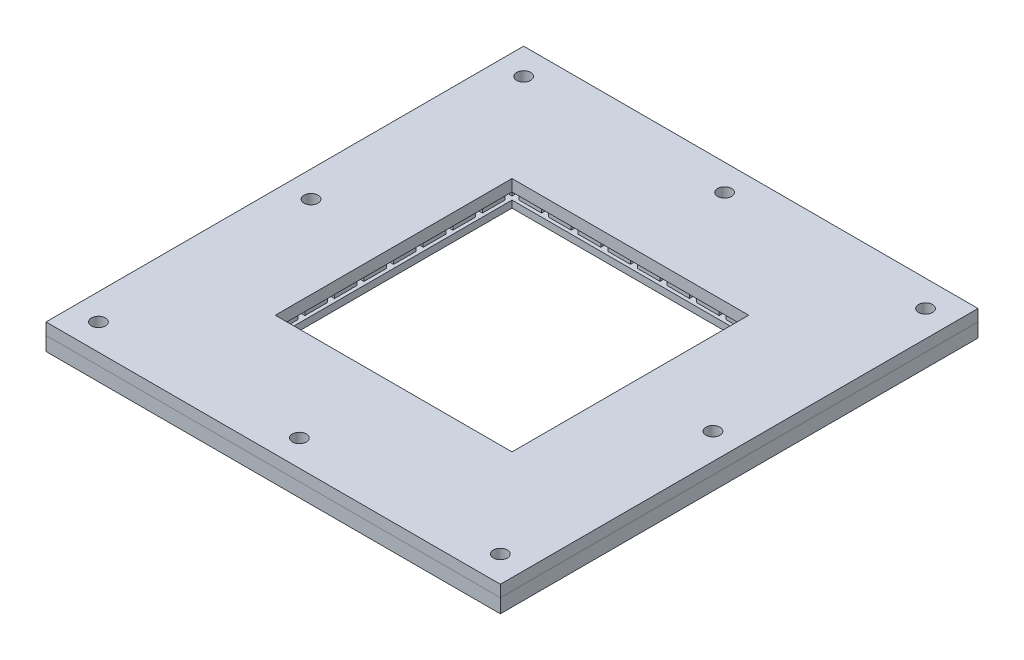
from build123d import *

# Parameters (mm, degrees)
SKETCH1_W                = 195
SKETCH1_H                = 205
SKETCH1_W_2              = 101.6
SKETCH1_H_2              = 101.6
BOSS_EXTRUDE1_DEPTH      = 6
SKETCH2_W                = 152.4
SKETCH2_H                = 3
CUT_EXTRUDE1_DEPTH       = 3
SKETCH3_W                = 3
SKETCH3_H                = 152.4
CUT_EXTRUDE2_DEPTH       = 3
LPATTERN1_COUNT          = 11
LPATTERN1_PITCH          = 12.7
LPATTERN2_COUNT          = 11
LPATTERN2_PITCH          = 12.7
MIRROR1_COPY_1_SKETCH_W  = 152.4
MIRROR1_COPY_1_SKETCH_H  = 3
MIRROR1_COPY_1_DEPTH     = 3
MIRROR1_COPY_2_SKETCH_W  = 152.4
MIRROR1_COPY_2_SKETCH_H  = 3
MIRROR1_COPY_2_DEPTH     = 3
MIRROR1_COPY_3_SKETCH_W  = 152.4
MIRROR1_COPY_3_SKETCH_H  = 3
MIRROR1_COPY_3_DEPTH     = 3
MIRROR1_COPY_4_SKETCH_W  = 152.4
MIRROR1_COPY_4_SKETCH_H  = 3
MIRROR1_COPY_4_DEPTH     = 3
MIRROR1_COPY_5_SKETCH_W  = 152.4
MIRROR1_COPY_5_SKETCH_H  = 3
MIRROR1_COPY_5_DEPTH     = 3
MIRROR1_COPY_6_SKETCH_W  = 152.4
MIRROR1_COPY_6_SKETCH_H  = 3
MIRROR1_COPY_6_DEPTH     = 3
MIRROR1_COPY_7_SKETCH_W  = 152.4
MIRROR1_COPY_7_SKETCH_H  = 3
MIRROR1_COPY_7_DEPTH     = 3
MIRROR1_COPY_8_SKETCH_W  = 152.4
MIRROR1_COPY_8_SKETCH_H  = 3
MIRROR1_COPY_8_DEPTH     = 3
MIRROR1_COPY_9_SKETCH_W  = 152.4
MIRROR1_COPY_9_SKETCH_H  = 3
MIRROR1_COPY_9_DEPTH     = 3
MIRROR1_COPY_10_SKETCH_W = 152.4
MIRROR1_COPY_10_SKETCH_H = 3
MIRROR1_COPY_10_DEPTH    = 3
MIRROR2_COPY_1_SKETCH_W  = 3
MIRROR2_COPY_1_SKETCH_H  = 152.4
MIRROR2_COPY_1_DEPTH     = 3
MIRROR2_COPY_2_SKETCH_W  = 3
MIRROR2_COPY_2_SKETCH_H  = 152.4
MIRROR2_COPY_2_DEPTH     = 3
MIRROR2_COPY_3_SKETCH_W  = 3
MIRROR2_COPY_3_SKETCH_H  = 152.4
MIRROR2_COPY_3_DEPTH     = 3
MIRROR2_COPY_4_SKETCH_W  = 3
MIRROR2_COPY_4_SKETCH_H  = 152.4
MIRROR2_COPY_4_DEPTH     = 3
MIRROR2_COPY_5_SKETCH_W  = 3
MIRROR2_COPY_5_SKETCH_H  = 152.4
MIRROR2_COPY_5_DEPTH     = 3
MIRROR2_COPY_6_SKETCH_W  = 3
MIRROR2_COPY_6_SKETCH_H  = 152.4
MIRROR2_COPY_6_DEPTH     = 3
MIRROR2_COPY_7_SKETCH_W  = 3
MIRROR2_COPY_7_SKETCH_H  = 152.4
MIRROR2_COPY_7_DEPTH     = 3
MIRROR2_COPY_8_SKETCH_W  = 3
MIRROR2_COPY_8_SKETCH_H  = 152.4
MIRROR2_COPY_8_DEPTH     = 3
MIRROR2_COPY_9_SKETCH_W  = 3
MIRROR2_COPY_9_SKETCH_H  = 152.4
MIRROR2_COPY_9_DEPTH     = 3
MIRROR2_COPY_10_SKETCH_W = 3
MIRROR2_COPY_10_SKETCH_H = 152.4
MIRROR2_COPY_10_DEPTH    = 3
SKETCH4_W                = 195
SKETCH4_H                = 205
SKETCH4_W_2              = 101.6
SKETCH4_H_2              = 101.6
BOSS_EXTRUDE2_DEPTH      = 5
SKETCH5_R                = 3
CUT_EXTRUDE3_DEPTH       = 142.892564992


with BuildPart() as part:
    # Sketch1 → Boss-Extrude1 (new body)
    with BuildSketch(Plane(origin=(0, 0, 0), x_dir=(1, 0, 0), z_dir=(0, 1, 0))):
        Rectangle(SKETCH1_W, SKETCH1_H)
        Rectangle(SKETCH1_W_2, SKETCH1_H_2, mode=Mode.SUBTRACT)
    extrude(amount=BOSS_EXTRUDE1_DEPTH)

    # Sketch2 → Cut-Extrude1 (cut)
    with BuildSketch(Plane(origin=(0, 6, 0), x_dir=(1, 0, 0), z_dir=(0, 1, 0))):
        with Locations((0, 76.2)):
            Rectangle(SKETCH2_W, SKETCH2_H)
    cut_extrude1 = extrude(amount=-CUT_EXTRUDE1_DEPTH, mode=Mode.SUBTRACT)

    # Sketch3 → Cut-Extrude2 (cut)
    with BuildSketch(Plane(origin=(0, 6, 0), x_dir=(1, 0, 0), z_dir=(0, 1, 0))):
        with Locations((-76.2, 0)):
            Rectangle(SKETCH3_W, SKETCH3_H)
    cut_extrude2 = extrude(amount=-CUT_EXTRUDE2_DEPTH, mode=Mode.SUBTRACT)

    # LPattern1: Cut-Extrude1 ×11
    with Locations(*[(0, 0, i * LPATTERN1_PITCH) for i in range(1, LPATTERN1_COUNT)]):
        add(cut_extrude1, mode=Mode.SUBTRACT)

    # LPattern2: Cut-Extrude2 ×11
    with Locations(*[(i * LPATTERN2_PITCH, 0, 0) for i in range(1, LPATTERN2_COUNT)]):
        add(cut_extrude2, mode=Mode.SUBTRACT)

    # Mirror1: Cut-Extrude1 across plane
    add(cut_extrude1.mirror(Plane.XY), mode=Mode.SUBTRACT)

    # Mirror1 copy 1 sketch → Mirror1 copy 1 (cut)
    with BuildSketch(Plane(origin=(0, 6, -12.7), x_dir=(1, 0, 0), z_dir=(0, 1, 0))):
        with Locations((0, -76.2)):
            Rectangle(MIRROR1_COPY_1_SKETCH_W, MIRROR1_COPY_1_SKETCH_H)
    extrude(amount=-MIRROR1_COPY_1_DEPTH, mode=Mode.SUBTRACT)

    # Mirror1 copy 2 sketch → Mirror1 copy 2 (cut)
    with BuildSketch(Plane(origin=(0, 6, -25.4), x_dir=(1, 0, 0), z_dir=(0, 1, 0))):
        with Locations((0, -76.2)):
            Rectangle(MIRROR1_COPY_2_SKETCH_W, MIRROR1_COPY_2_SKETCH_H)
    extrude(amount=-MIRROR1_COPY_2_DEPTH, mode=Mode.SUBTRACT)

    # Mirror1 copy 3 sketch → Mirror1 copy 3 (cut)
    with BuildSketch(Plane(origin=(0, 6, -38.1), x_dir=(1, 0, 0), z_dir=(0, 1, 0))):
        with Locations((0, -76.2)):
            Rectangle(MIRROR1_COPY_3_SKETCH_W, MIRROR1_COPY_3_SKETCH_H)
    extrude(amount=-MIRROR1_COPY_3_DEPTH, mode=Mode.SUBTRACT)

    # Mirror1 copy 4 sketch → Mirror1 copy 4 (cut)
    with BuildSketch(Plane(origin=(0, 6, -50.8), x_dir=(1, 0, 0), z_dir=(0, 1, 0))):
        with Locations((0, -76.2)):
            Rectangle(MIRROR1_COPY_4_SKETCH_W, MIRROR1_COPY_4_SKETCH_H)
    extrude(amount=-MIRROR1_COPY_4_DEPTH, mode=Mode.SUBTRACT)

    # Mirror1 copy 5 sketch → Mirror1 copy 5 (cut)
    with BuildSketch(Plane(origin=(0, 6, -63.5), x_dir=(1, 0, 0), z_dir=(0, 1, 0))):
        with Locations((0, -76.2)):
            Rectangle(MIRROR1_COPY_5_SKETCH_W, MIRROR1_COPY_5_SKETCH_H)
    extrude(amount=-MIRROR1_COPY_5_DEPTH, mode=Mode.SUBTRACT)

    # Mirror1 copy 6 sketch → Mirror1 copy 6 (cut)
    with BuildSketch(Plane(origin=(0, 6, -76.2), x_dir=(1, 0, 0), z_dir=(0, 1, 0))):
        with Locations((0, -76.2)):
            Rectangle(MIRROR1_COPY_6_SKETCH_W, MIRROR1_COPY_6_SKETCH_H)
    extrude(amount=-MIRROR1_COPY_6_DEPTH, mode=Mode.SUBTRACT)

    # Mirror1 copy 7 sketch → Mirror1 copy 7 (cut)
    with BuildSketch(Plane(origin=(0, 6, -88.9), x_dir=(1, 0, 0), z_dir=(0, 1, 0))):
        with Locations((0, -76.2)):
            Rectangle(MIRROR1_COPY_7_SKETCH_W, MIRROR1_COPY_7_SKETCH_H)
    extrude(amount=-MIRROR1_COPY_7_DEPTH, mode=Mode.SUBTRACT)

    # Mirror1 copy 8 sketch → Mirror1 copy 8 (cut)
    with BuildSketch(Plane(origin=(0, 6, -101.6), x_dir=(1, 0, 0), z_dir=(0, 1, 0))):
        with Locations((0, -76.2)):
            Rectangle(MIRROR1_COPY_8_SKETCH_W, MIRROR1_COPY_8_SKETCH_H)
    extrude(amount=-MIRROR1_COPY_8_DEPTH, mode=Mode.SUBTRACT)

    # Mirror1 copy 9 sketch → Mirror1 copy 9 (cut)
    with BuildSketch(Plane(origin=(0, 6, -114.3), x_dir=(1, 0, 0), z_dir=(0, 1, 0))):
        with Locations((0, -76.2)):
            Rectangle(MIRROR1_COPY_9_SKETCH_W, MIRROR1_COPY_9_SKETCH_H)
    extrude(amount=-MIRROR1_COPY_9_DEPTH, mode=Mode.SUBTRACT)

    # Mirror1 copy 10 sketch → Mirror1 copy 10 (cut)
    with BuildSketch(Plane(origin=(0, 6, -127), x_dir=(1, 0, 0), z_dir=(0, 1, 0))):
        with Locations((0, -76.2)):
            Rectangle(MIRROR1_COPY_10_SKETCH_W, MIRROR1_COPY_10_SKETCH_H)
    extrude(amount=-MIRROR1_COPY_10_DEPTH, mode=Mode.SUBTRACT)

    # Mirror2: Cut-Extrude2 across plane
    add(cut_extrude2.mirror(Plane(origin=(0, 0, 0), x_dir=(0, 0, 1), z_dir=(1, 0, 0))), mode=Mode.SUBTRACT)

    # Mirror2 copy 1 sketch → Mirror2 copy 1 (cut)
    with BuildSketch(Plane(origin=(-12.7, 6, 0), x_dir=(-1, 0, 0), z_dir=(0, 1, 0))):
        with Locations((-76.2, 0)):
            Rectangle(MIRROR2_COPY_1_SKETCH_W, MIRROR2_COPY_1_SKETCH_H)
    extrude(amount=-MIRROR2_COPY_1_DEPTH, mode=Mode.SUBTRACT)

    # Mirror2 copy 2 sketch → Mirror2 copy 2 (cut)
    with BuildSketch(Plane(origin=(-25.4, 6, 0), x_dir=(-1, 0, 0), z_dir=(0, 1, 0))):
        with Locations((-76.2, 0)):
            Rectangle(MIRROR2_COPY_2_SKETCH_W, MIRROR2_COPY_2_SKETCH_H)
    extrude(amount=-MIRROR2_COPY_2_DEPTH, mode=Mode.SUBTRACT)

    # Mirror2 copy 3 sketch → Mirror2 copy 3 (cut)
    with BuildSketch(Plane(origin=(-38.1, 6, 0), x_dir=(-1, 0, 0), z_dir=(0, 1, 0))):
        with Locations((-76.2, 0)):
            Rectangle(MIRROR2_COPY_3_SKETCH_W, MIRROR2_COPY_3_SKETCH_H)
    extrude(amount=-MIRROR2_COPY_3_DEPTH, mode=Mode.SUBTRACT)

    # Mirror2 copy 4 sketch → Mirror2 copy 4 (cut)
    with BuildSketch(Plane(origin=(-50.8, 6, 0), x_dir=(-1, 0, 0), z_dir=(0, 1, 0))):
        with Locations((-76.2, 0)):
            Rectangle(MIRROR2_COPY_4_SKETCH_W, MIRROR2_COPY_4_SKETCH_H)
    extrude(amount=-MIRROR2_COPY_4_DEPTH, mode=Mode.SUBTRACT)

    # Mirror2 copy 5 sketch → Mirror2 copy 5 (cut)
    with BuildSketch(Plane(origin=(-63.5, 6, 0), x_dir=(-1, 0, 0), z_dir=(0, 1, 0))):
        with Locations((-76.2, 0)):
            Rectangle(MIRROR2_COPY_5_SKETCH_W, MIRROR2_COPY_5_SKETCH_H)
    extrude(amount=-MIRROR2_COPY_5_DEPTH, mode=Mode.SUBTRACT)

    # Mirror2 copy 6 sketch → Mirror2 copy 6 (cut)
    with BuildSketch(Plane(origin=(-76.2, 6, 0), x_dir=(-1, 0, 0), z_dir=(0, 1, 0))):
        with Locations((-76.2, 0)):
            Rectangle(MIRROR2_COPY_6_SKETCH_W, MIRROR2_COPY_6_SKETCH_H)
    extrude(amount=-MIRROR2_COPY_6_DEPTH, mode=Mode.SUBTRACT)

    # Mirror2 copy 7 sketch → Mirror2 copy 7 (cut)
    with BuildSketch(Plane(origin=(-88.9, 6, 0), x_dir=(-1, 0, 0), z_dir=(0, 1, 0))):
        with Locations((-76.2, 0)):
            Rectangle(MIRROR2_COPY_7_SKETCH_W, MIRROR2_COPY_7_SKETCH_H)
    extrude(amount=-MIRROR2_COPY_7_DEPTH, mode=Mode.SUBTRACT)

    # Mirror2 copy 8 sketch → Mirror2 copy 8 (cut)
    with BuildSketch(Plane(origin=(-101.6, 6, 0), x_dir=(-1, 0, 0), z_dir=(0, 1, 0))):
        with Locations((-76.2, 0)):
            Rectangle(MIRROR2_COPY_8_SKETCH_W, MIRROR2_COPY_8_SKETCH_H)
    extrude(amount=-MIRROR2_COPY_8_DEPTH, mode=Mode.SUBTRACT)

    # Mirror2 copy 9 sketch → Mirror2 copy 9 (cut)
    with BuildSketch(Plane(origin=(-114.3, 6, 0), x_dir=(-1, 0, 0), z_dir=(0, 1, 0))):
        with Locations((-76.2, 0)):
            Rectangle(MIRROR2_COPY_9_SKETCH_W, MIRROR2_COPY_9_SKETCH_H)
    extrude(amount=-MIRROR2_COPY_9_DEPTH, mode=Mode.SUBTRACT)

    # Mirror2 copy 10 sketch → Mirror2 copy 10 (cut)
    with BuildSketch(Plane(origin=(-127, 6, 0), x_dir=(-1, 0, 0), z_dir=(0, 1, 0))):
        with Locations((-76.2, 0)):
            Rectangle(MIRROR2_COPY_10_SKETCH_W, MIRROR2_COPY_10_SKETCH_H)
    extrude(amount=-MIRROR2_COPY_10_DEPTH, mode=Mode.SUBTRACT)


with BuildPart() as body_2:
    # Sketch4 → Boss-Extrude2 (new body)
    with BuildSketch(Plane(origin=(0, 6, 0), x_dir=(1, 0, 0), z_dir=(0, 1, 0))):
        Rectangle(SKETCH4_W, SKETCH4_H)
        Rectangle(SKETCH4_W_2, SKETCH4_H_2, mode=Mode.SUBTRACT)
    extrude(amount=BOSS_EXTRUDE2_DEPTH)


with BuildPart() as cut_extrude3_tool:
    # Sketch5 → Cut-Extrude3 (new, through all)
    with BuildSketch(Plane(origin=(0, 11, 0), x_dir=(1, 0, 0), z_dir=(0, 1, 0))):
        with Locations(Location((-86.25, 91.25, 0), (0, 0, 270))):
            Circle(SKETCH5_R)
        with Locations(Location((0, 91.25, 0), (0, 0, 270))):
            Circle(SKETCH5_R)
        with Locations(Location((86.25, 91.25, 0), (0, 0, 270))):
            Circle(SKETCH5_R)
        with Locations(Location((-86.25, 0, 0), (0, 0, 270))):
            Circle(SKETCH5_R)
        with Locations(Location((86.25, 0, 0), (0, 0, 270))):
            Circle(SKETCH5_R)
        with Locations(Location((86.25, -91.25, 0), (0, 0, 270))):
            Circle(SKETCH5_R)
        with Locations(Location((0, -91.25, 0), (0, 0, 270))):
            Circle(SKETCH5_R)
        with Locations(Location((-86.25, -91.25, 0), (0, 0, 270))):
            Circle(SKETCH5_R)
    extrude(amount=-CUT_EXTRUDE3_DEPTH)


with BuildPart() as part_1:
    add(part.part)

    # Cut-Extrude3: cut by cut_extrude3_tool
    add(cut_extrude3_tool.part, mode=Mode.SUBTRACT)


with BuildPart() as body_2_1:
    add(body_2.part)

    # Cut-Extrude3: cut by cut_extrude3_tool
    add(cut_extrude3_tool.part, mode=Mode.SUBTRACT)


solid = Compound([part_1.part, body_2_1.part])
